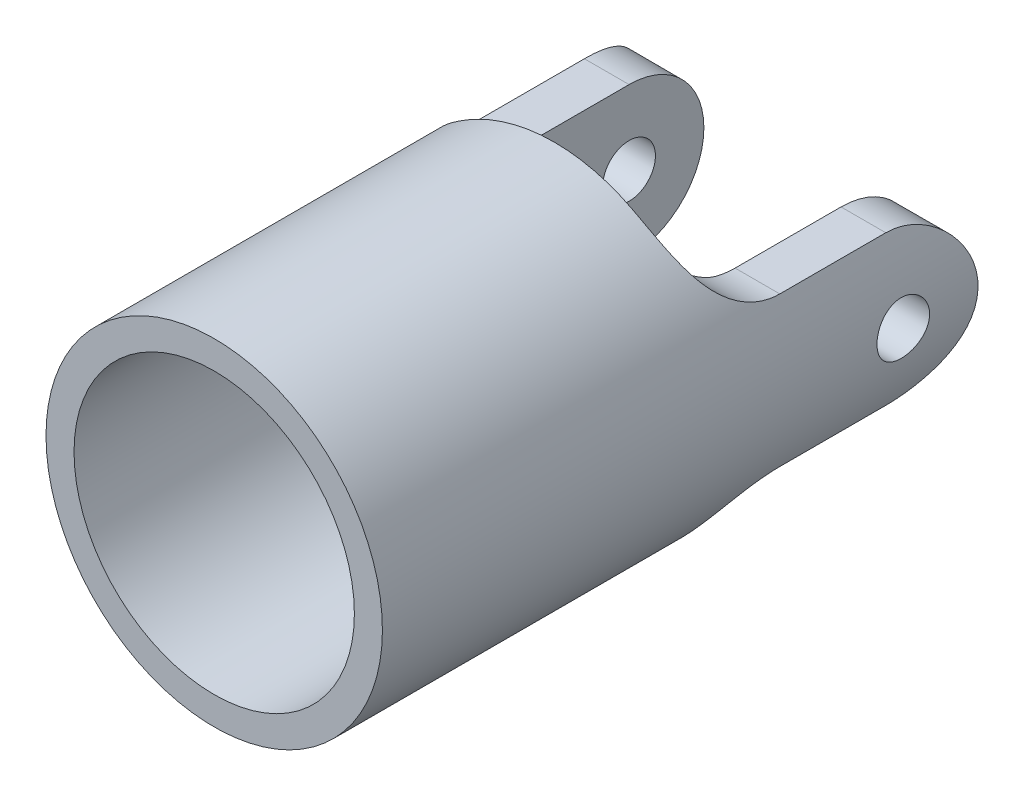
from build123d import *

# Parameters (mm, degrees)
CUT_EXTRUDE1_DEPTH      = 38.432697939
CUT_EXTRUDE1_DEPTH_BACK = 38.432697939
CUT_EXTRUDE2_DEPTH      = 38.432698083
CUT_EXTRUDE2_DEPTH_BACK = 38.432698083
SKETCH5_W               = 23.799010272
SKETCH5_H               = 22.882778694
CUT_EXTRUDE3_DEPTH      = 5.43
CUT_EXTRUDE4_DEPTH      = 25.43
CUT_EXTRUDE4_DEPTH_BACK = 15.43
SKETCH6_R               = 1.49


with BuildPart() as part:
    # Sketch1 → Revolve1 (revolve)
    with BuildSketch(Plane(origin=(0, 0, 0), x_dir=(0, 0, -1), z_dir=(1, 0, 0))):
        Polygon((-34.925, 9.525), (-34.925, 7.9375), (-15.925, 7.9375), (-15.925, 0), (9.525, 0), (9.525, 9.525), align=None)
    revolve(axis=Axis((0, 0, 0), (0, 0, 1)))

    # Sketch3 → Cut-Extrude1 (cut, two sides: drawn at the far end of the back side and taken through both)
    with BuildSketch(Plane(origin=(0, 0, 0), x_dir=(0, 0, -1), z_dir=(1, 0, 0)).offset(-CUT_EXTRUDE1_DEPTH_BACK)):
        with BuildLine():
            Line((9.525, 9.525), (-10.233333333, 9.525))
            Line((-10.233333333, 9.525), (-10.233333333, 8.466666667))
            ThreePointArc((-10.233333333, 8.466666667), (-8.993418707, 5.47324796), (-6, 4.233333333))
            Line((-6, 4.233333333), (0, 4.233333333))
            ThreePointArc((0, 4.233333333), (4.233333333, 0), (0, -4.233333333))
            Line((0, -4.233333333), (-6, -4.233333333))
            ThreePointArc((-6, -4.233333333), (-8.993418707, -5.47324796), (-10.233333333, -8.466666667))
            Line((-10.233333333, -8.466666667), (-10.233333333, -9.525))
            Line((-10.233333333, -9.525), (9.525, -9.525))
            Line((9.525, -9.525), (9.525, 9.525))
        make_face()
    extrude(amount=CUT_EXTRUDE1_DEPTH + CUT_EXTRUDE1_DEPTH_BACK, mode=Mode.SUBTRACT)

    # Sketch4 → Cut-Extrude2 (cut, two sides: drawn at the far end of the back side and taken through both)
    with BuildSketch(Plane(origin=(0, 0, 0), x_dir=(1, 0, 0), z_dir=(0, 1, 0)).offset(-CUT_EXTRUDE2_DEPTH_BACK)):
        with BuildLine():
            Line((-2.825, -10.233333333), (2.825, -10.233333333))
            ThreePointArc((2.825, -10.233333333), (5.07006403, -9.303397364), (6, -7.058333333))
            Line((6, -7.058333333), (6, 4.233333333))
            Line((6, 4.233333333), (-6, 4.233333333))
            Line((-6, 4.233333333), (-6, -7.058333333))
            ThreePointArc((-6, -7.058333333), (-5.07006403, -9.303397364), (-2.825, -10.233333333))
        make_face()
    extrude(amount=CUT_EXTRUDE2_DEPTH + CUT_EXTRUDE2_DEPTH_BACK, mode=Mode.SUBTRACT)

    # Sketch5 → Cut-Extrude3 (cut)
    with BuildSketch(Plane.XY.offset(34.925)):
        Rectangle(SKETCH5_W, SKETCH5_H)
    extrude(amount=-CUT_EXTRUDE3_DEPTH, mode=Mode.SUBTRACT)

    # Sketch6 → Cut-Extrude4 (cut, two sides: drawn at the far end of the back side and taken through both)
    with BuildSketch(Plane(origin=(-6, 0, 0), x_dir=(0, 0, -1), z_dir=(1, 0, 0)).offset(-CUT_EXTRUDE4_DEPTH_BACK)):
        Circle(SKETCH6_R)
    extrude(amount=CUT_EXTRUDE4_DEPTH + CUT_EXTRUDE4_DEPTH_BACK, mode=Mode.SUBTRACT)


solid = part.part
